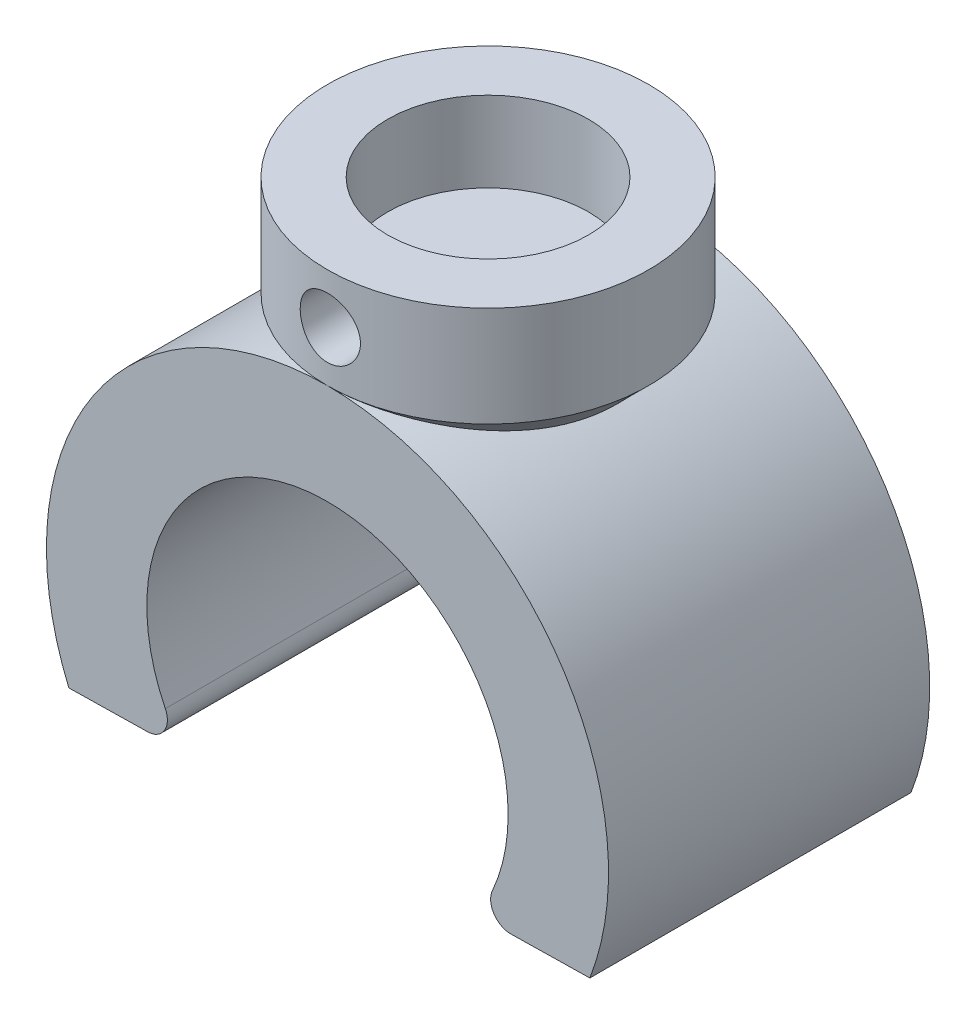
from build123d import *

# Parameters (mm, degrees)
SKETCH1_R           = 14
BOSS_EXTRUDE1_DEPTH = 16
CUT_EXTRUDE1_REACH  = 27.456
SKETCH2_R           = 9
CUT_EXTRUDE2_DEPTH  = 26.455844123
BOSS_EXTRUDE2_START = 11
SKETCH4_R           = 5
BOSS_EXTRUDE2_DEPTH = 3
BOSS_EXTRUDE2_DRAFT = -45
SKETCH5_R           = 8
BOSS_EXTRUDE3_DEPTH = 5
SKETCH6_R           = 5
CUT_EXTRUDE3_DEPTH  = 4
CUT_EXTRUDE4_START  = 17
SKETCH7_R           = 1.5
CUT_EXTRUDE4_DEPTH  = 5
FILLET1_R           = 1


with BuildPart() as part:
    # Sketch1 → Boss-Extrude1 (new body)
    with BuildSketch(Plane.XY):
        Circle(SKETCH1_R)
    extrude(amount=BOSS_EXTRUDE1_DEPTH)

    # Sketch2 → Cut-Extrude1 (cut, up to next)
    with BuildSketch(Plane.XY.offset(16), mode=Mode.PRIVATE) as cut_extrude1_sk1:
        Circle(SKETCH2_R)
    cut_extrude1_tool1 = extrude(cut_extrude1_sk1.sketch, amount=-CUT_EXTRUDE1_REACH, mode=Mode.PRIVATE) & part.part
    add(cut_extrude1_tool1.solids().sort_by_distance((0, 0, 16))[0], mode=Mode.SUBTRACT)

    # Sketch3 → Cut-Extrude2 (cut, through all)
    with BuildSketch(Plane.XY.offset(16)):
        Polygon((-14, -5.5), (14, -5), (14, -14), (-14, -14), align=None)
    extrude(amount=-CUT_EXTRUDE2_DEPTH, mode=Mode.SUBTRACT)


with BuildPart() as boss_extrude2_tool:
    # Sketch4 → Boss-Extrude2 (with draft: the straight prism first)
    with BuildSketch(Plane(origin=(0, 0, 0), x_dir=(-1, 0, 0), z_dir=(0, 1, 0)).offset(BOSS_EXTRUDE2_START)):
        with Locations((0, 8)):
            Circle(SKETCH4_R)
    extrude(amount=BOSS_EXTRUDE2_DEPTH)
    # Boss-Extrude2: the draft: its side faces are tilted about the plane it starts from
    boss_extrude2_sides = [boss_extrude2_tool.faces().sort_by_distance(p)[0] for p in [
        (5, 12.5, 8),
    ]]
    draft(boss_extrude2_sides, Plane(origin=(0, 0, 0), x_dir=(-1, 0, 0), z_dir=(0, 1, 0)).offset(BOSS_EXTRUDE2_START), BOSS_EXTRUDE2_DRAFT)


with BuildPart() as part_1:
    add(part.part)

    # Boss-Extrude2: add boss_extrude2_tool
    add(boss_extrude2_tool.part)

    # Sketch5 → Boss-Extrude3 (add)
    with BuildSketch(Plane(origin=(0, 14, 0), x_dir=(1, 0, 0), z_dir=(0, 1, 0))):
        with Locations(Location((0, -8, 0), (0, 0, 270))):
            Circle(SKETCH5_R)
    extrude(amount=BOSS_EXTRUDE3_DEPTH)

    # Sketch6 → Cut-Extrude3 (cut)
    with BuildSketch(Plane(origin=(0, 19, 0), x_dir=(1, 0, 0), z_dir=(0, 1, 0))):
        with Locations(Location((0, -8, 0), (0, 0, 270))):
            Circle(SKETCH6_R)
    extrude(amount=-CUT_EXTRUDE3_DEPTH, mode=Mode.SUBTRACT)

    # Sketch7 → Cut-Extrude4 (cut)
    with BuildSketch(Plane.XY.offset(CUT_EXTRUDE4_START)):
        with Locations(Location((0, 16.5, 0), (0, 0, 270))):
            Circle(SKETCH7_R)
    extrude(amount=-CUT_EXTRUDE4_DEPTH, mode=Mode.SUBTRACT)

    # Fillet1
    fillet1_edges = [part_1.edges().sort_by_distance(p)[0] for p in [
        (7.403251486, -5.117799081, 8),
        (-7.215811257, -5.378853772, 8),
    ]]
    fillet(fillet1_edges, radius=FILLET1_R)


solid = part_1.part
